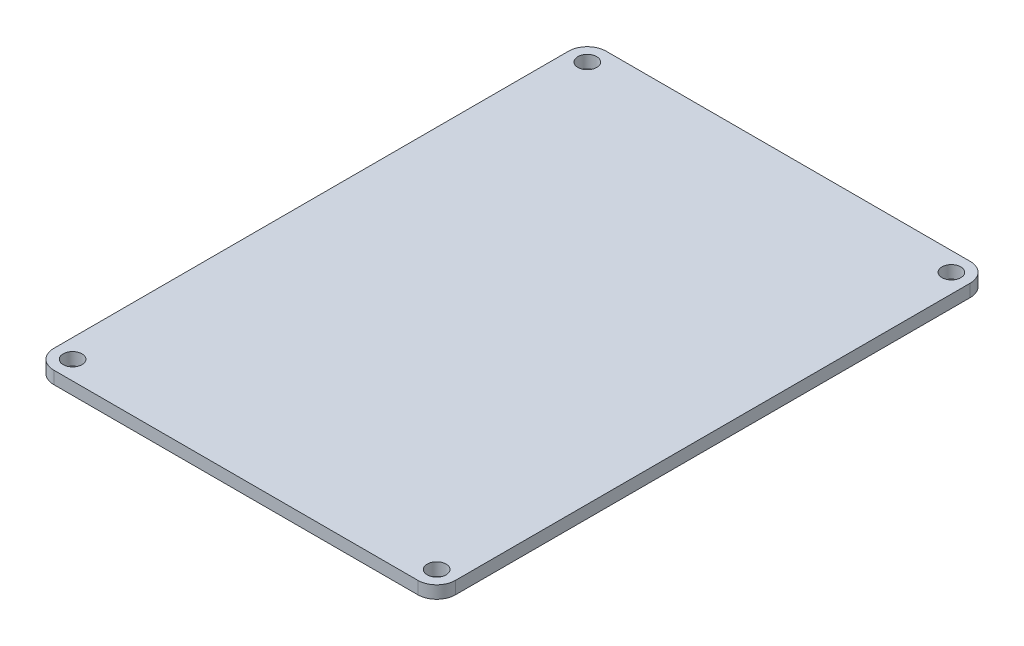
from build123d import *

# Parameters (mm, degrees)
SKETCH1_W               = 64
SKETCH1_H               = 88
BOSS_EXTRUDE1_DEPTH     = 1
FILLET1_R               = 3
SKETCH2_R               = 1.5
CUT_EXTRUDE1_DEPTH      = 55.442630355
MIRROR2_COPY_1_SKETCH_R = 1.5
MIRROR2_COPY_1_DEPTH    = 55.442630355


with BuildPart() as part:
    # Sketch1 → Boss-Extrude1 (new, symmetric)
    with BuildSketch(Plane(origin=(0, 0, 0), x_dir=(1, 0, 0), z_dir=(0, 1, 0))):
        Rectangle(SKETCH1_W, SKETCH1_H)
    extrude(amount=BOSS_EXTRUDE1_DEPTH, both=True)

    # Fillet1
    fillet1_edges = [part.edges().sort_by_distance(p)[0] for p in [
        (32, 0, 44),
        (-32, 0, 44),
        (-32, 0, -44),
        (32, 0, -44),
    ]]
    fillet(fillet1_edges, radius=FILLET1_R)

    # Sketch2 → Cut-Extrude1 (cut, symmetric)
    with BuildSketch(Plane(origin=(0, 1, 0), x_dir=(1, 0, 0), z_dir=(0, 1, 0))):
        with Locations(Location((-29, 41, 0), (0, 0, 270))):
            Circle(SKETCH2_R)
    cut_extrude1 = extrude(amount=CUT_EXTRUDE1_DEPTH, both=True, mode=Mode.SUBTRACT)

    # Mirror1: Cut-Extrude1 across plane
    add(cut_extrude1.mirror(Plane(origin=(0, 0, 0), x_dir=(0, 0, 1), z_dir=(1, 0, 0))), mode=Mode.SUBTRACT)

    # Mirror2: Cut-Extrude1 across plane
    add(cut_extrude1.mirror(Plane.XY), mode=Mode.SUBTRACT)

    # Mirror2 copy 1 sketch → Mirror2 copy 1 (cut, symmetric)
    with BuildSketch(Plane(origin=(0, 1, 0), x_dir=(-1, 0, 0), z_dir=(0, 1, 0))):
        with Locations(Location((-29, 41, 0), (0, 0, 270))):
            Circle(MIRROR2_COPY_1_SKETCH_R)
    extrude(amount=MIRROR2_COPY_1_DEPTH, both=True, mode=Mode.SUBTRACT)


solid = part.part
